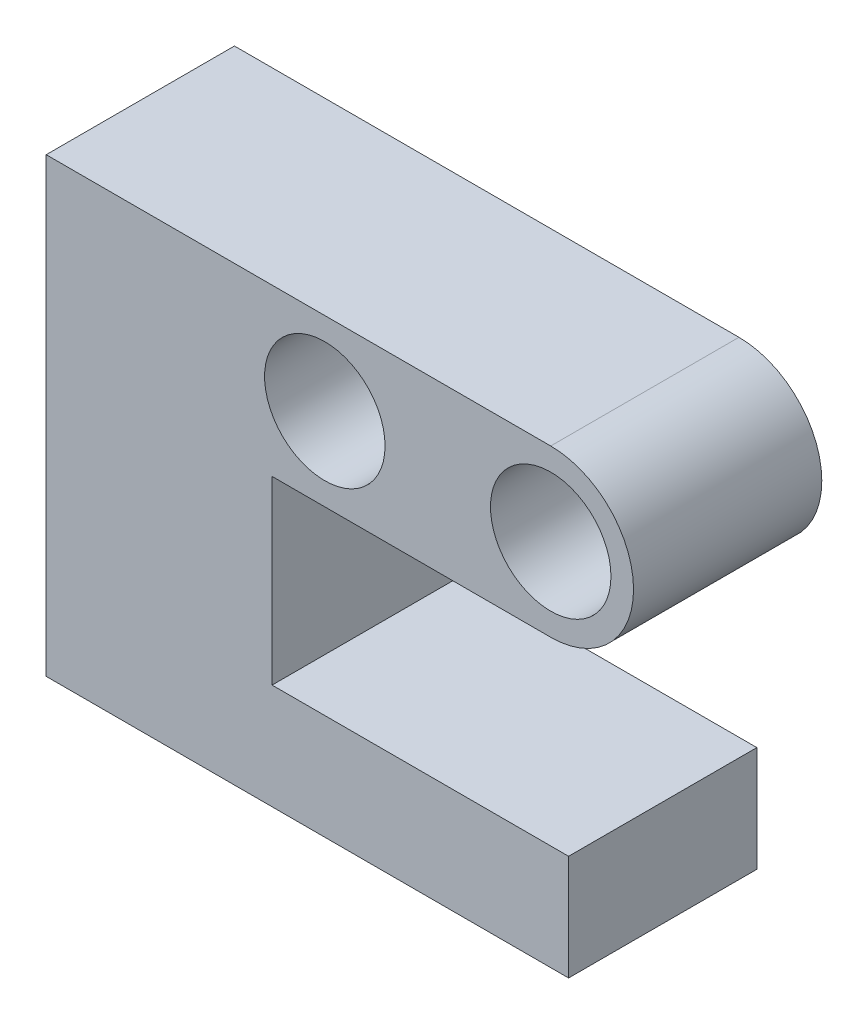
from build123d import *

# Parameters (mm, degrees)
SKETCH1_R           = 8
BOSS_EXTRUDE1_DEPTH = 25
SKETCH2_R           = 4
CUT_EXTRUDE1_DEPTH  = 17


with BuildPart() as part:
    # Sketch1 → Boss-Extrude1 (new body)
    with BuildSketch(Plane.XY):
        with BuildLine():
            Line((-30, 11), (0, 11))
            ThreePointArc((0, 11), (11, 0), (0, -11))
            Line((0, -11), (-30, -11))
            Line((-30, -11), (-37, -11))
            Line((-37, -11), (-37, -35))
            Line((-37, -35), (2.374237314, -35))
            Line((2.374237314, -35), (2.374237314, -49))
            Line((2.374237314, -49), (-37, -49))
            Line((-37, -49), (-67, -49))
            Line((-67, -49), (-67, 11))
            Line((-67, 11), (-30, 11))
        make_face()
        Circle(SKETCH1_R, mode=Mode.SUBTRACT)
        with Locations((-30, 0)):
            Circle(SKETCH1_R, mode=Mode.SUBTRACT)
    extrude(amount=BOSS_EXTRUDE1_DEPTH)

    # Sketch2 → Cut-Extrude1 (cut)
    with BuildSketch(Plane.ZY.offset(67)):
        with Locations(Location((12.5, 1, 0), (0, 0, 270))):
            Circle(SKETCH2_R)
        with Locations(Location((12.5, -39, 0), (0, 0, 270))):
            Circle(SKETCH2_R)
    extrude(amount=-CUT_EXTRUDE1_DEPTH, mode=Mode.SUBTRACT)


solid = part.part
